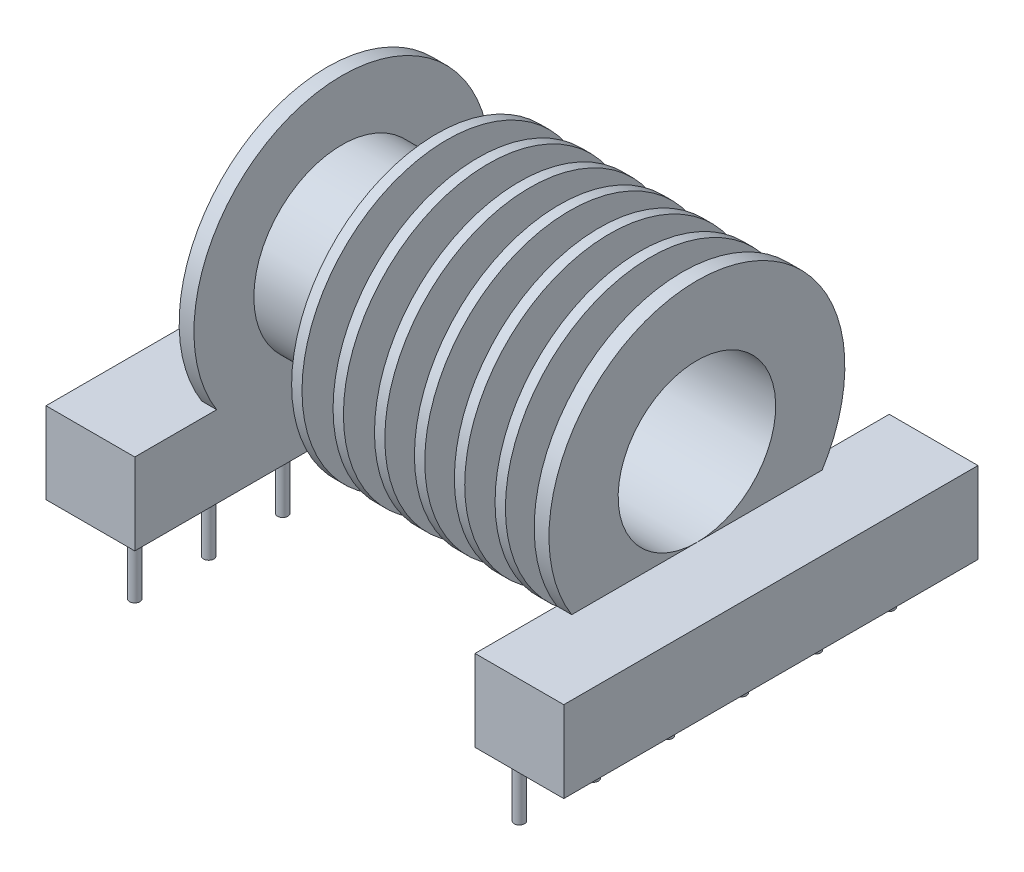
from build123d import *

# Parameters (mm, degrees)
SKETCH_2_W      = 0.7
SKETCH_2_H      = 4.413249275
SKETCH_3_W      = 6
SKETCH_3_H      = 5.5
EXTRUDE_1_DEPTH = 14
SKETCH_4_R      = 0.35
EXTRUDE_2_DEPTH = 4.3


with BuildPart() as part:
    # 草图1 → 旋转1 (revolve)
    with BuildSketch(Plane.XY, mode=Mode.PRIVATE) as revolve_1_sk:
        Polygon((0, 10), (1, 10), (1, 5.95), (24, 5.95), (24, 10), (25, 10), (25, 5.325), (0, 5.325), align=None)
    revolve(revolve_1_sk.sketch.rotate(Axis((15.438516229, 0, 0), (-1, 0, 0)), 90), axis=Axis((15.438516229, 0, 0), (-1, 0, 0)))

    # 草图2 → 旋转2 (revolve)
    with BuildSketch(Plane.XY, mode=Mode.PRIVATE) as revolve_2_sk:
        with Locations((7.75, 7.589473804)):
            Rectangle(SKETCH_2_W, SKETCH_2_H)
        with Locations((10.55, 7.589473804)):
            Rectangle(SKETCH_2_W, SKETCH_2_H)
        with Locations((13.35, 7.589473804)):
            Rectangle(SKETCH_2_W, SKETCH_2_H)
        with Locations((16.05, 7.589473804)):
            Rectangle(SKETCH_2_W, SKETCH_2_H)
        with Locations((18.75, 7.589473804)):
            Rectangle(SKETCH_2_W, SKETCH_2_H)
        with Locations((21.5, 7.589473804)):
            Rectangle(SKETCH_2_W, SKETCH_2_H)
    revolve(revolve_2_sk.sketch.rotate(Axis((-4.318730042, 0, 0), (1, 0, 0)), 270), axis=Axis((-4.318730042, 0, 0), (1, 0, 0)))

    # 草图3 → 凸台-拉伸1 (add, symmetric)
    with BuildSketch(Plane.XY):
        with Locations((-2, -8.075)):
            Rectangle(SKETCH_3_W, SKETCH_3_H)
        with Locations((27, -8.075)):
            Rectangle(SKETCH_3_W, SKETCH_3_H)
    extrude(amount=EXTRUDE_1_DEPTH, both=True)

    # 草图4 → 凸台-拉伸2 (add)
    with BuildSketch(Plane.XZ.offset(10.825)):
        with Locations(Location((-0.5, 12.5, 0), (0, 0, 180))):
            Circle(SKETCH_4_R)
        with Locations(Location((-0.5, 7.5, 0), (0, 0, 180))):
            Circle(SKETCH_4_R)
        with Locations(Location((-0.5, 2.5, 0), (0, 0, 180))):
            Circle(SKETCH_4_R)
        with Locations(Location((-0.5, -2.5, 0), (0, 0, 180))):
            Circle(SKETCH_4_R)
        with Locations(Location((-0.5, -7.5, 0), (0, 0, 180))):
            Circle(SKETCH_4_R)
        with Locations(Location((-0.5, -12.5, 0), (0, 0, 180))):
            Circle(SKETCH_4_R)
        with Locations(Location((25.5, -12.5, 0), (0, 0, 90))):
            Circle(SKETCH_4_R)
        with Locations(Location((25.5, -7.5, 0), (0, 0, 90))):
            Circle(SKETCH_4_R)
        with Locations(Location((25.5, -2.5, 0), (0, 0, 90))):
            Circle(SKETCH_4_R)
        with Locations(Location((25.5, 2.5, 0), (0, 0, 90))):
            Circle(SKETCH_4_R)
        with Locations(Location((25.5, 7.5, 0), (0, 0, 90))):
            Circle(SKETCH_4_R)
        with Locations(Location((25.5, 12.5, 0), (0, 0, 90))):
            Circle(SKETCH_4_R)
    extrude(amount=EXTRUDE_2_DEPTH)


solid = part.part
